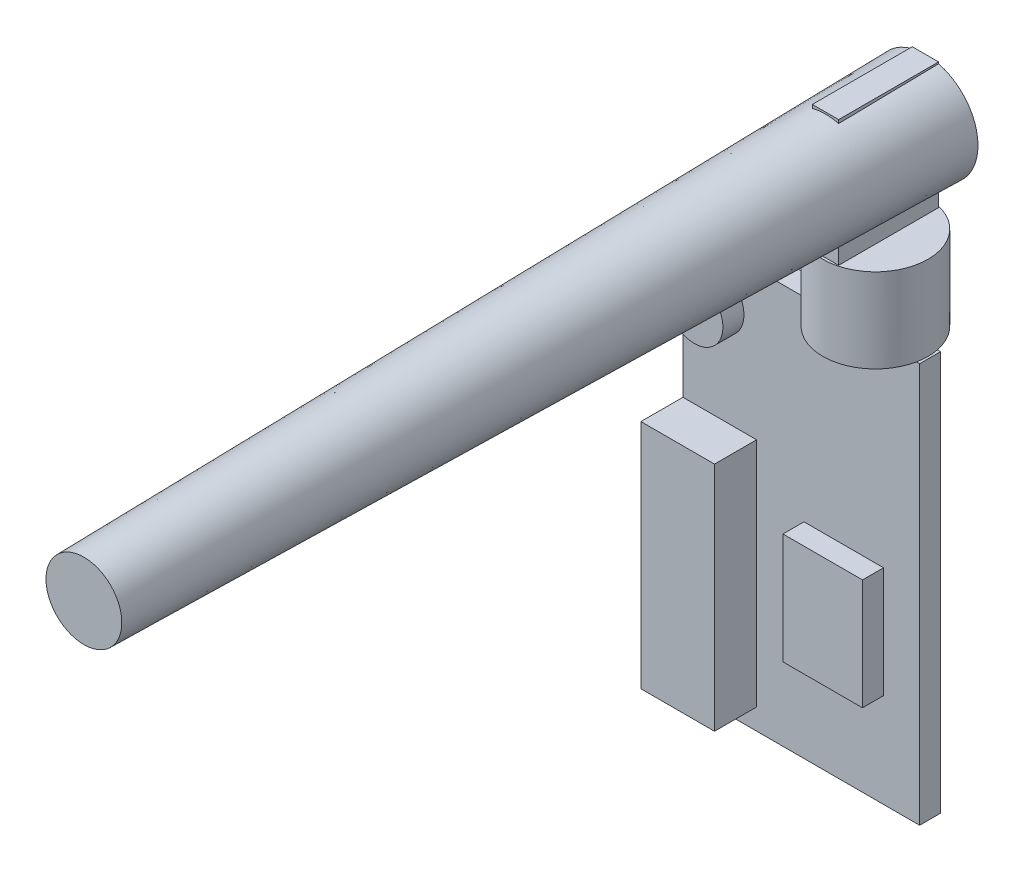
from build123d import *

# Parameters (mm, degrees)
SKETCH1_W           = 22.5
SKETCH1_H           = 38
BOSS_EXTRUDE1_DEPTH = 2
SKETCH2_W           = 7
SKETCH2_H           = 22
BOSS_EXTRUDE2_DEPTH = 4
SKETCH3_R           = 2.706246926
SKETCH3_W           = 7.563295119
SKETCH3_H           = 10.529749536
BOSS_EXTRUDE3_DEPTH = 2
SKETCH4_W           = 3.522294841
SKETCH4_H           = 18.892308692
CUT_EXTRUDE1_DEPTH  = 6
SKETCH5_R           = 5
BOSS_EXTRUDE4_DEPTH = 20
SKETCH6_OUTSIDE_W   = 37.102
SKETCH6_OUTSIDE_H   = 24.602
SKETCH6_OUTSIDE_W_2 = 2.5
SKETCH6_OUTSIDE_H_2 = 9.5
CUT_EXTRUDE2_DEPTH  = 12
SKETCH7_R           = 5
BOSS_EXTRUDE5_DEPTH = 80
BOSS_EXTRUDE5_DRAFT = -1


with BuildPart() as part:
    # Sketch1 → Boss-Extrude1 (new body)
    with BuildSketch(Plane.XY):
        Rectangle(SKETCH1_W, SKETCH1_H)
    extrude(amount=BOSS_EXTRUDE1_DEPTH)

    # Sketch2 → Boss-Extrude2 (add)
    with BuildSketch(Plane.XY.offset(2)):
        with Locations((-7.75, -6.011083038)):
            Rectangle(SKETCH2_W, SKETCH2_H)
    extrude(amount=BOSS_EXTRUDE2_DEPTH)

    # Sketch3 → Boss-Extrude3 (add)
    with BuildSketch(Plane.XY.offset(2)):
        with Locations(Location((-8.15823298, 14.663341742, 0), (0, 0, 180))):
            Circle(SKETCH3_R)
        with Locations((4.035174314, -4.778762907)):
            Rectangle(SKETCH3_W, SKETCH3_H)
    extrude(amount=BOSS_EXTRUDE3_DEPTH)

    # Sketch4 → Cut-Extrude1 (cut)
    with BuildSketch(Plane.ZY.offset(11.25)):
        with Locations((3.240156467, -5.963885583)):
            Rectangle(SKETCH4_W, SKETCH4_H)
    extrude(amount=-CUT_EXTRUDE1_DEPTH, mode=Mode.SUBTRACT)

    # Sketch5 → Boss-Extrude4 (add)
    with BuildSketch(Plane(origin=(0, 19, 0), x_dir=(1, 0, 0), z_dir=(0, 1, 0))):
        with Locations(Location((6.05, -1, 0), (0, 0, 168.463040967))):
            Circle(SKETCH5_R)
    extrude(amount=BOSS_EXTRUDE4_DEPTH)

    # Sketch6 outside → Cut-Extrude2 (cut)
    with BuildSketch(Plane(origin=(0, 39, 0), x_dir=(1, 0, 0), z_dir=(0, 1, 0))):
        with Locations((0, -1)):
            Rectangle(SKETCH6_OUTSIDE_W, SKETCH6_OUTSIDE_H)
        with Locations((6.05, -1)):
            Rectangle(SKETCH6_OUTSIDE_W_2, SKETCH6_OUTSIDE_H_2, mode=Mode.SUBTRACT)
    extrude(amount=-CUT_EXTRUDE2_DEPTH, mode=Mode.SUBTRACT)


with BuildPart() as boss_extrude5_tool:
    # Sketch7 → Boss-Extrude5 (with draft: the straight prism first)
    with BuildSketch(Plane(origin=(0, 0, -3.75), x_dir=(-1, 0, 0), z_dir=(0, 0, -1))):
        with Locations((-6.05, 34)):
            Circle(SKETCH7_R)
    extrude(amount=-BOSS_EXTRUDE5_DEPTH)
    # Boss-Extrude5: the draft: its side faces are tilted about the plane it starts from
    boss_extrude5_sides = [boss_extrude5_tool.faces().sort_by_distance(p)[0] for p in [
        (11.05, 34, 36.25),
    ]]
    draft(boss_extrude5_sides, Plane(origin=(0, 0, -3.75), x_dir=(-1, 0, 0), z_dir=(0, 0, -1)), BOSS_EXTRUDE5_DRAFT)


with BuildPart() as part_1:
    add(part.part)

    # Boss-Extrude5: add boss_extrude5_tool
    add(boss_extrude5_tool.part)


solid = part_1.part
